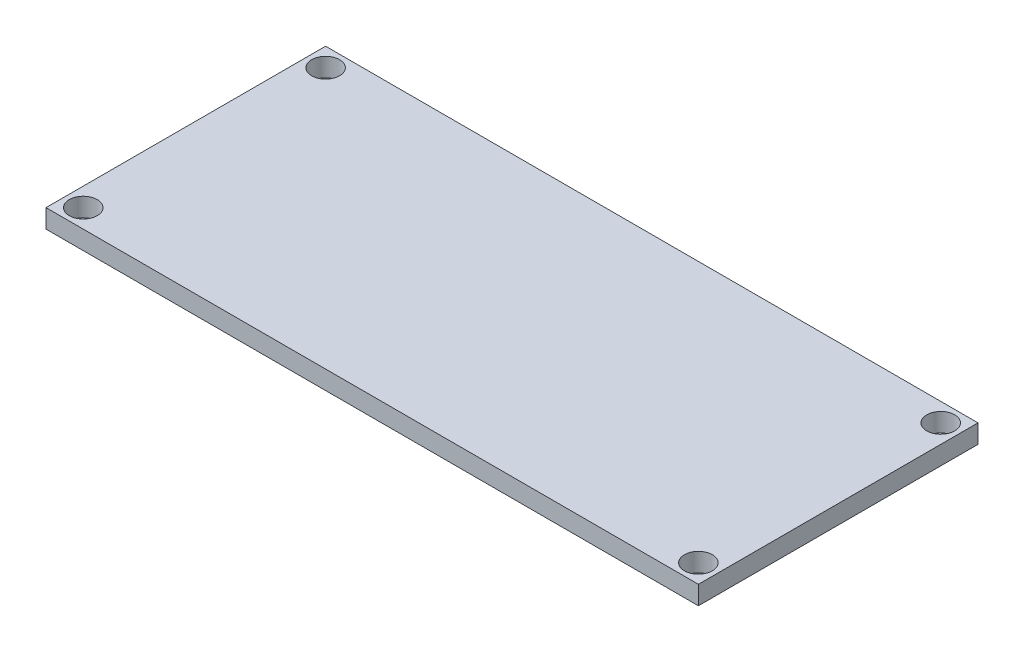
from build123d import *

# Parameters (mm, degrees)
SKETCH_1_W      = 70
SKETCH_1_H      = 30
SKETCH_1_R      = 1.5
EXTRUDE_1_DEPTH = 2


with BuildPart() as part:
    # 草图1 → 凸台-拉伸1 (new body)
    with BuildSketch(Plane(origin=(0, 0, 0), x_dir=(1, 0, 0), z_dir=(0, 1, 0))):
        with Locations((35, -15)):
            Rectangle(SKETCH_1_W, SKETCH_1_H)
        with Locations(Location((68, -28, 0), (0, 0, 270))):
            Circle(SKETCH_1_R, mode=Mode.SUBTRACT)
        with Locations(Location((2, -28, 0), (0, 0, 270))):
            Circle(SKETCH_1_R, mode=Mode.SUBTRACT)
        with Locations(Location((68, -2, 0), (0, 0, 270))):
            Circle(SKETCH_1_R, mode=Mode.SUBTRACT)
        with Locations(Location((2, -2, 0), (0, 0, 270))):
            Circle(SKETCH_1_R, mode=Mode.SUBTRACT)
    extrude(amount=EXTRUDE_1_DEPTH)


solid = part.part
